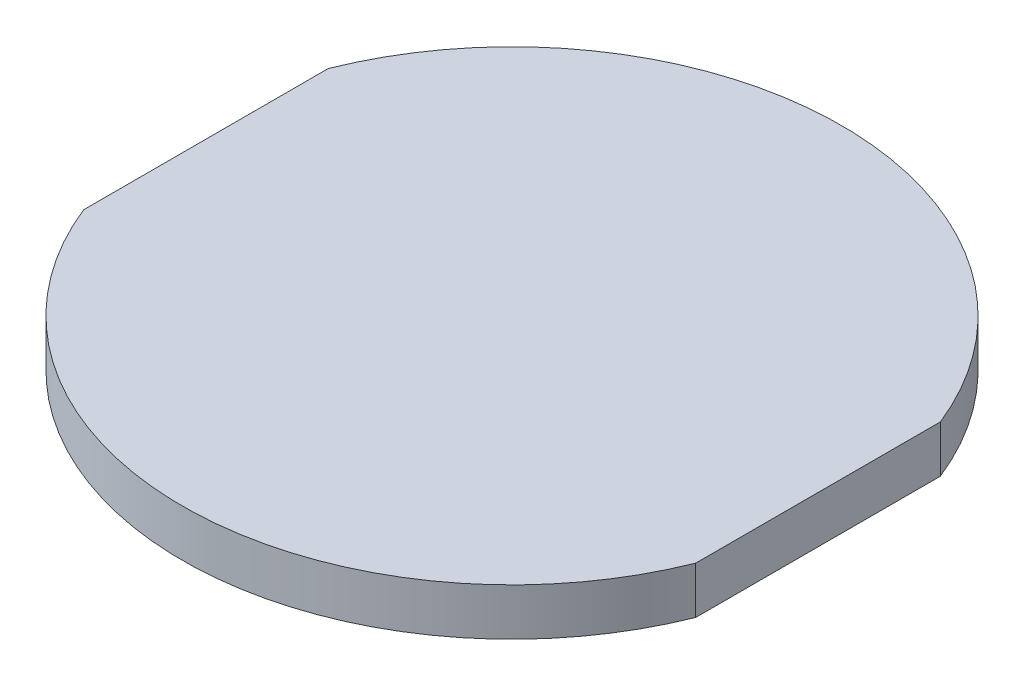
from build123d import *

# Parameters (mm, degrees)
BOSS_EXTRUDE1_DEPTH = 1


with BuildPart() as part:
    # Sketch2 → Boss-Extrude1 (new body)
    with BuildSketch(Plane(origin=(0, 0, 0), x_dir=(1, 0, 0), z_dir=(0, 1, 0))):
        with BuildLine():
            Line((-6.5, 2.598076211), (-6.5, -2.598076211))
            ThreePointArc((-6.5, -2.598076211), (0, -7), (6.5, -2.598076211))
            Line((6.5, -2.598076211), (6.5, 2.598076211))
            ThreePointArc((6.5, 2.598076211), (0, 7), (-6.5, 2.598076211))
        make_face()
    extrude(amount=BOSS_EXTRUDE1_DEPTH)


solid = part.part
